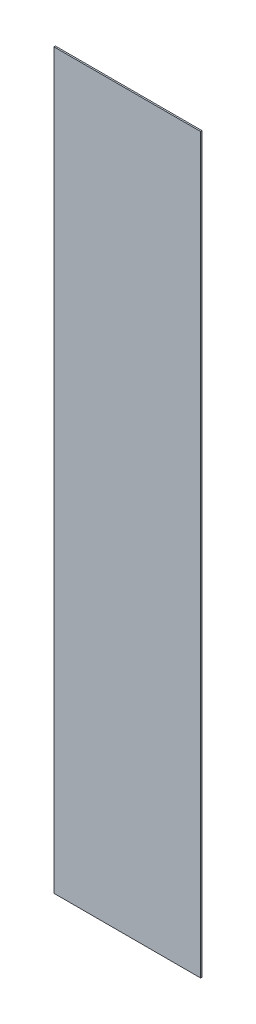
from build123d import *

# Parameters (mm, degrees)
SKETCH1_W           = 10
SKETCH1_H           = 50
BOSS_EXTRUDE1_DEPTH = 0.1


with BuildPart() as part:
    # Sketch1 → Boss-Extrude1 (new body)
    with BuildSketch(Plane.XY):
        Rectangle(SKETCH1_W, SKETCH1_H)
    extrude(amount=BOSS_EXTRUDE1_DEPTH)


solid = part.part
